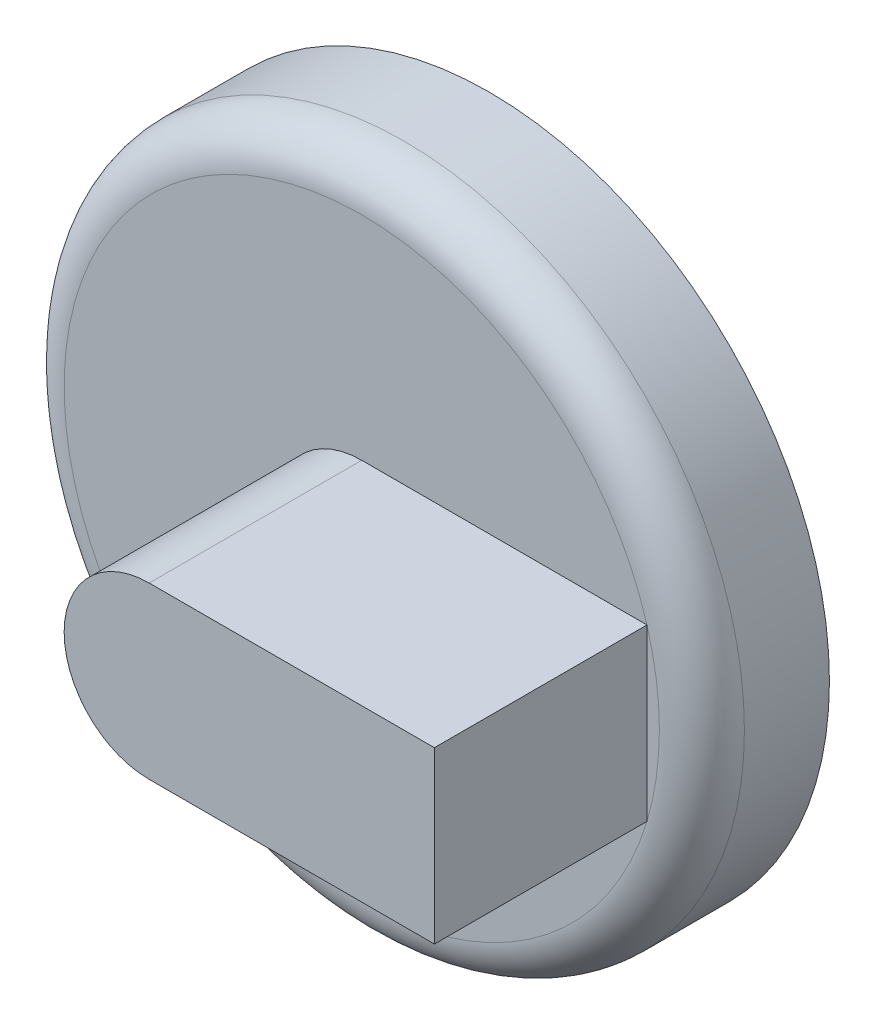
from build123d import *

# Parameters (mm, degrees)
SKETCH1_R           = 40
BOSS_EXTRUDE1_DEPTH = 15
FILLET1_R           = 5
SKETCH2_R           = 10
BOSS_EXTRUDE2_DEPTH = 25
SCALE1_SCALE        = 2
SKETCH3_W           = 67.082039325
SKETCH3_H           = 40
BOSS_EXTRUDE3_DEPTH = 50


with BuildPart() as part:
    # Sketch1 → Boss-Extrude1 (new body)
    with BuildSketch(Plane.XY):
        Circle(SKETCH1_R)
    extrude(amount=BOSS_EXTRUDE1_DEPTH)

    # Fillet1
    fillet1_edges = [part.edges().sort_by_distance(p)[0] for p in [
        (-40, 0, 15),
    ]]
    fillet(fillet1_edges, radius=FILLET1_R)

    # Sketch2 → Boss-Extrude2 (add)
    with BuildSketch(Plane.XY.offset(15)):
        Circle(SKETCH2_R)
    extrude(amount=BOSS_EXTRUDE2_DEPTH)


with BuildPart() as part_1:
    # Scale1: scaled about (0, 0, 9.31508132)
    add(part.part.scale(SCALE1_SCALE).moved(Location((0, 0, -9.31508132))))

    # Sketch3 → Boss-Extrude3 (add)
    with BuildSketch(Plane.XY.offset(70.68491868)):
        with Locations((33.541019663, 0)):
            Rectangle(SKETCH3_W, SKETCH3_H)
    extrude(amount=-BOSS_EXTRUDE3_DEPTH)


solid = part_1.part
